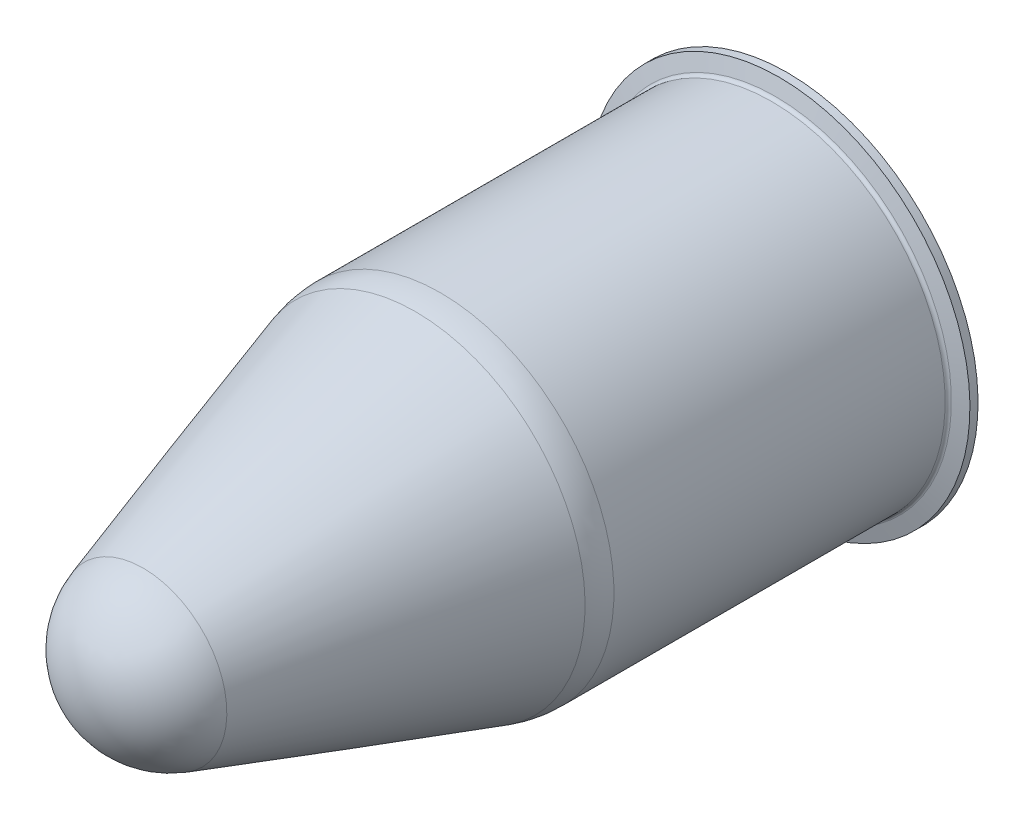
from build123d import *


with BuildPart() as part:
    # Sketch1 → Revolve2 (revolve)
    with BuildSketch(Plane(origin=(0, 0, 0), x_dir=(0, 0, -1), z_dir=(1, 0, 0))):
        with BuildLine():
            Line((0, 145.188), (0, 165))
            Line((0, 165), (-7, 165))
            Line((-7, 165), (-10.388686575, 152.353249532))
            ThreePointArc((-10.388686575, 152.353249532), (-11.522683536, 150.656103145), (-13.455501073, 150))
            Line((-13.455501073, 150), (-300, 150))
            ThreePointArc((-300, 150), (-310.960991624, 149.173944589), (-321.674372861, 146.714439069))
            ThreePointArc((-321.674372861, 146.714439069), (-439.541828247, 109.825171624), (-557.228519945, 72.363221744))
            ThreePointArc((-557.228519945, 72.363221744), (-595.405893511, 44.780757498), (-610, 0))
            Line((-610, 0), (-608.984, 0))
            ThreePointArc((-608.984, 0), (-594.259282427, 44.625319466), (-555.868158289, 71.724360639))
            ThreePointArc((-555.868158289, 71.724360639), (-438.8556959, 107.09296389), (-321.674372861, 141.898020722))
            ThreePointArc((-321.674372861, 141.898020722), (-311.025475884, 144.220518359), (-300.154164534, 145))
            Line((-300.154164534, 145), (-10.388686575, 145))
            Line((-10.388686575, 145), (-7, 145.188))
            Line((-7, 145.188), (0, 145.188))
        make_face()
    revolve(axis=Axis((0, 0, 0), (0, 0, 1)))


solid = part.part
